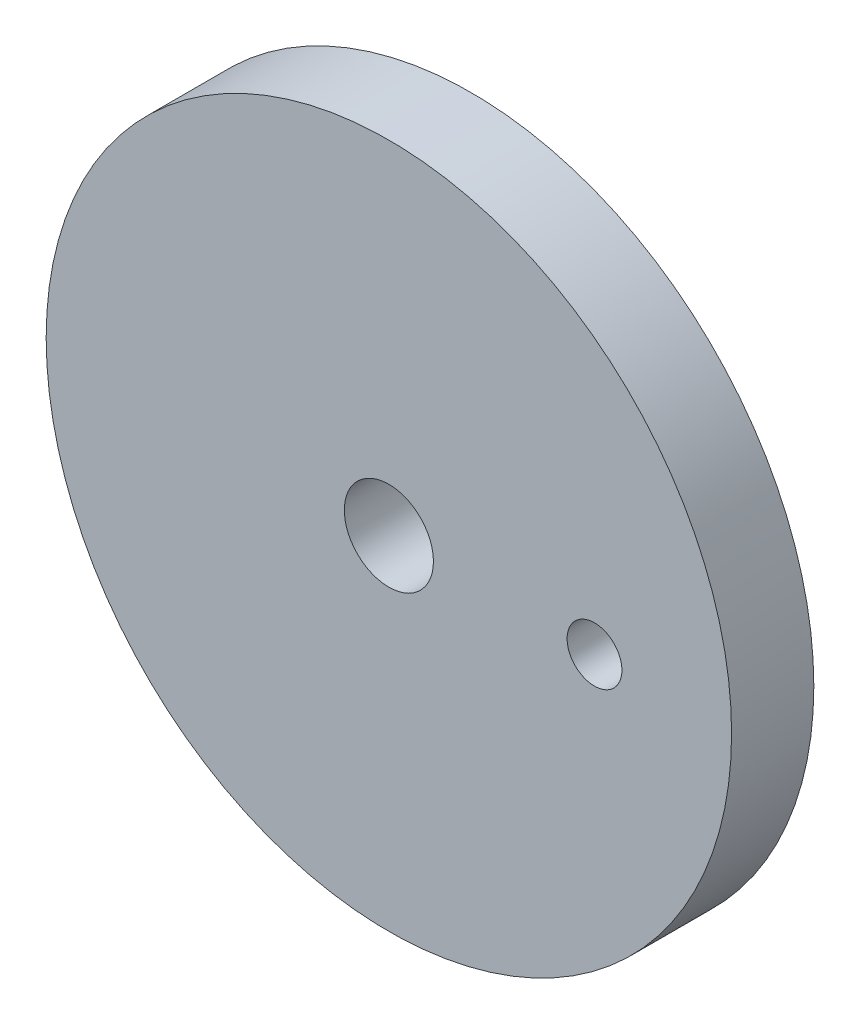
from build123d import *

# Parameters (mm, degrees)
ESBO_O1_R                = 25
ESBO_O1_R_2              = 3.25
RESSALTO_EXTRUS_O1_DEPTH = 3
ESBO_O2_R                = 2
CORTE_EXTRUS_O1_DEPTH    = 36.860842154


with BuildPart() as part:
    # Esboço1 → Ressalto-extrusão1 (new, symmetric)
    with BuildSketch(Plane.XY):
        Circle(ESBO_O1_R)
        Circle(ESBO_O1_R_2, mode=Mode.SUBTRACT)
    extrude(amount=RESSALTO_EXTRUS_O1_DEPTH, both=True)

    # Esboço2 → Corte-extrusão1 (cut, through all)
    with BuildSketch(Plane.XY.offset(3)):
        with Locations((15, 0)):
            Circle(ESBO_O2_R)
    extrude(amount=-CORTE_EXTRUS_O1_DEPTH, mode=Mode.SUBTRACT)


solid = part.part
